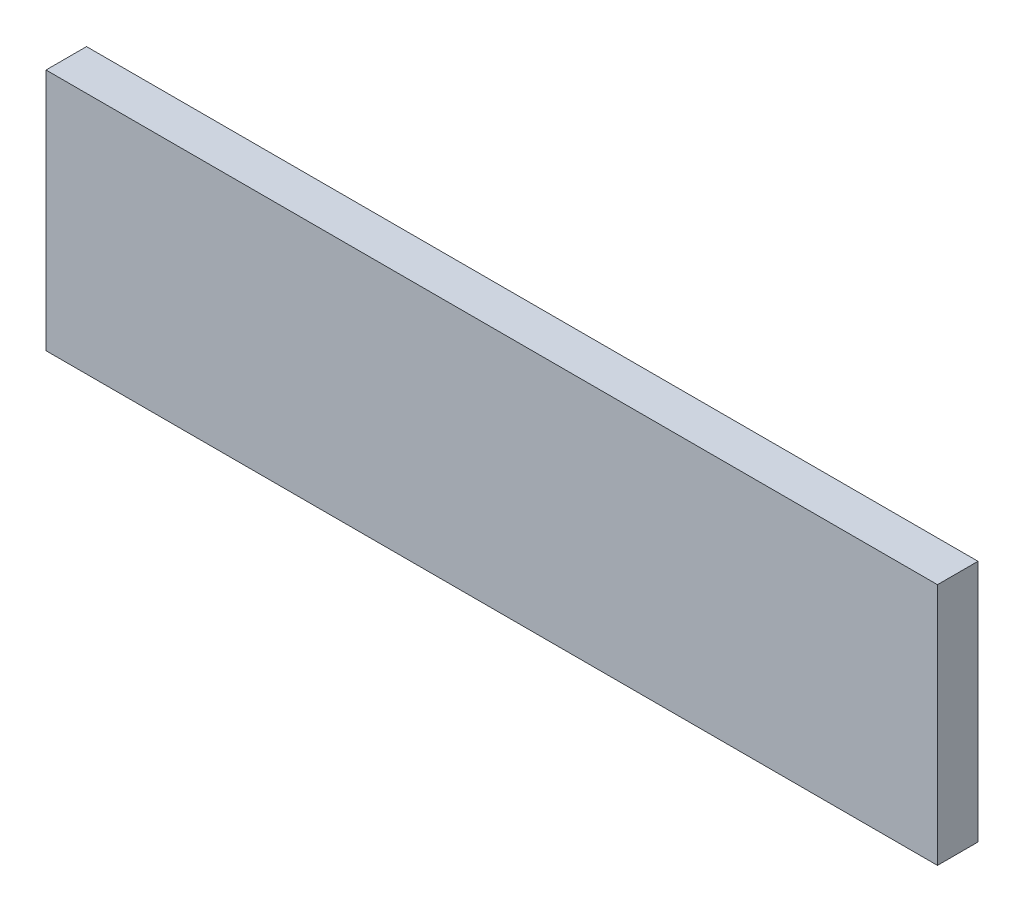
from build123d import *

# Parameters (mm, degrees)
SKETCH1_W           = 50.8
SKETCH1_H           = 304.8
BOSS_EXTRUDE1_DEPTH = 1117.6


with BuildPart() as part:
    # Sketch1 → Boss-Extrude1 (new body)
    with BuildSketch(Plane(origin=(0, 0, 0), x_dir=(0, 0, -1), z_dir=(1, 0, 0))):
        with Locations((25.4, 152.4)):
            Rectangle(SKETCH1_W, SKETCH1_H)
    extrude(amount=BOSS_EXTRUDE1_DEPTH)


solid = part.part
